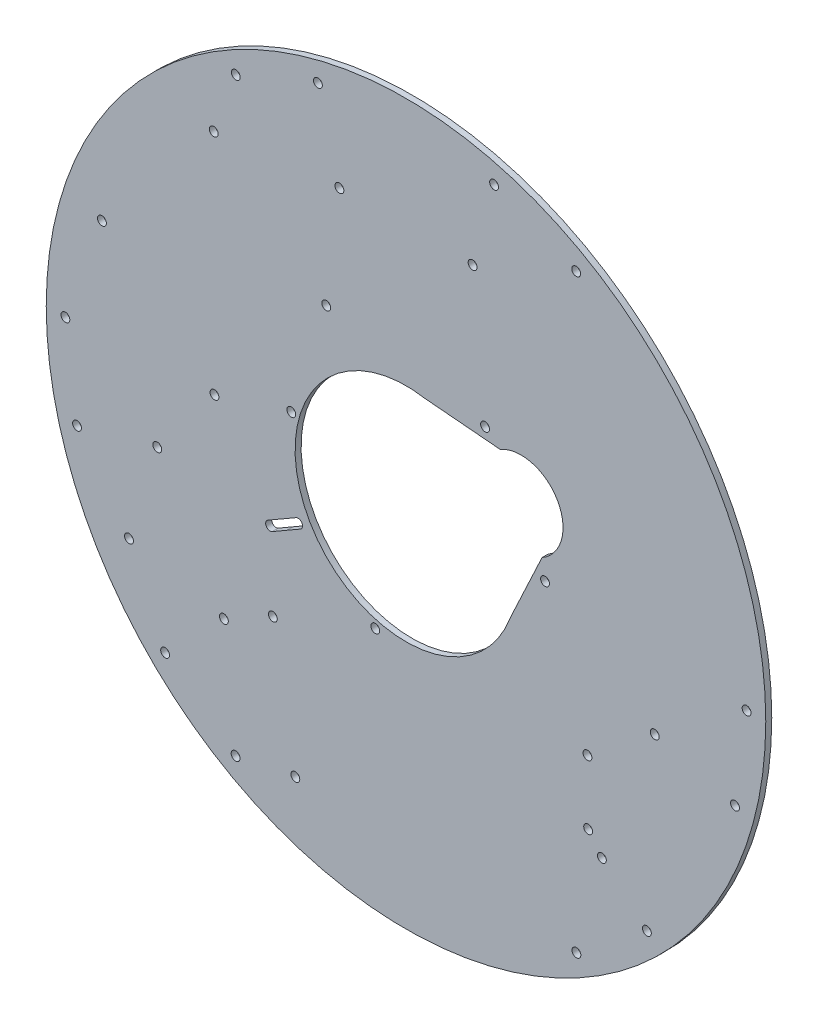
from build123d import *

# Parameters (mm, degrees)
SKETCH1_R           = 120.00268075
SKETCH1_R_2         = 1.475
BOSS_EXTRUDE1_DEPTH = 2


with BuildPart() as part:
    # Sketch1 → Boss-Extrude1 (new body)
    with BuildSketch(Plane.XY):
        with Locations((-29.695990648, 44.165693097)):
            Circle(SKETCH1_R)
        with Locations((-131.117764712, 78.090450262)):
            Circle(SKETCH1_R_2, mode=Mode.SUBTRACT)
        with Locations((-93.581586999, 46.593857387)):
            Circle(SKETCH1_R_2, mode=Mode.SUBTRACT)
        with Locations((-56.299905637, 91.024435088)):
            Circle(SKETCH1_R_2, mode=Mode.SUBTRACT)
        with Locations((-93.83608335, 122.521027963)):
            Circle(SKETCH1_R_2, mode=Mode.SUBTRACT)
        with Locations((-110.045426455, -36.150986818)):
            Circle(SKETCH1_R_2, mode=Mode.SUBTRACT)
        with Locations((-122.090933715, -9.178552154)):
            Circle(SKETCH1_R_2, mode=Mode.SUBTRACT)
        with Locations((-90.443310675, -16.556862192)):
            Circle(SKETCH1_R_2, mode=Mode.SUBTRACT)
        with Locations((-86.537268392, -54.200307389)):
            Circle(SKETCH1_R_2, mode=Mode.SUBTRACT)
        with Locations((-66.607427563, -50.274288778)):
            Circle(SKETCH1_R_2, mode=Mode.SUBTRACT)
        with Locations((-74.107508579, -7.739215663)):
            Circle(SKETCH1_R_2, mode=Mode.SUBTRACT)
        with Locations((-139.426993706, 14.739380466)):
            Circle(SKETCH1_R_2, mode=Mode.SUBTRACT)
        with Locations((-112.656926125, 21.918248387)):
            Circle(SKETCH1_R_2, mode=Mode.SUBTRACT)
        with Locations((-143.304084809, 44.12270283)):
            Circle(SKETCH1_R_2, mode=Mode.SUBTRACT)
        with BuildLine():
            ThreePointArc((-66.409488535, 24.672278037), (-65.290263608, 24.819626794), (-64.394660767, 24.132406564))
            ThreePointArc((-64.394660767, 24.132406564), (-64.247310389, 23.013187685), (-64.934521394, 22.117585057))
            Line((-64.934521394, 22.117585057), (-69.391907416, 19.544061572))
            Line((-69.391907416, 19.544061572), (-74.290393291, 16.715919433))
            ThreePointArc((-74.290393291, 16.715919433), (-75.409651382, 16.56856631), (-76.305280761, 17.255806904))
            ThreePointArc((-76.305280761, 17.255806904), (-76.452633885, 18.375064995), (-75.765393291, 19.270694374))
            Line((-75.765393291, 19.270694374), (-70.866896569, 22.098842775))
            Line((-70.866896569, 22.098842775), (-66.409488535, 24.672278037))
        make_face(mode=Mode.SUBTRACT)
        with Locations((-39.944701954, 5.916981791)):
            Circle(SKETCH1_R_2, mode=Mode.SUBTRACT)
        with Locations((27.145287096, -54.200307389)):
            Circle(SKETCH1_R_2, mode=Mode.SUBTRACT)
        with Locations((50.653445159, -36.150986818)):
            Circle(SKETCH1_R_2, mode=Mode.SUBTRACT)
        with Locations((31.051329379, -16.556862192)):
            Circle(SKETCH1_R_2, mode=Mode.SUBTRACT)
        with Locations((35.640132692, -22.598732381)):
            Circle(SKETCH1_R_2, mode=Mode.SUBTRACT)
        with BuildLine():
            ThreePointArc((-23.271008074, 7.727806236), (-45.332866332, 10.632304977), (-61.738930588, 25.665693097))
            ThreePointArc((-61.738930588, 25.665693097), (-66.555194477, 47.390455579), (-58.039635043, 67.948834656))
            ThreePointArc((-58.039635043, 67.948834656), (-42.381951879, 78.922942523), (-23.336458345, 80.615060018))
            Line((-23.336458345, 80.615060018), (1.683916538, 78.448698496))
            ThreePointArc((1.683916538, 78.448698496), (20.808272191, 73.324342843), (15.683916538, 54.19998719))
            Line((15.683916538, 54.19998719), (5.049853209, 31.448526168))
            ThreePointArc((5.049853209, 31.448526168), (-5.938310295, 15.800703687), (-23.271008074, 7.727806236))
        make_face(mode=Mode.SUBTRACT)
        with Locations((16.677076311, 47.845185022)):
            Circle(SKETCH1_R_2, mode=Mode.SUBTRACT)
        with Locations((30.83159843, 4.671820563)):
            Circle(SKETCH1_R_2, mode=Mode.SUBTRACT)
        with Locations((53.264944829, 21.918248387)):
            Circle(SKETCH1_R_2, mode=Mode.SUBTRACT)
        with Locations((80.03501241, 14.739380466)):
            Circle(SKETCH1_R_2, mode=Mode.SUBTRACT)
        with Locations((83.912103514, 44.12270283)):
            Circle(SKETCH1_R_2, mode=Mode.SUBTRACT)
        with Locations((-67.944701954, 54.414404403)):
            Circle(SKETCH1_R_2, mode=Mode.SUBTRACT)
        with Locations((-51.909606098, 127.135693097)):
            Circle(SKETCH1_R_2, mode=Mode.SUBTRACT)
        with Locations((-86.462807065, 142.57468385)):
            Circle(SKETCH1_R_2, mode=Mode.SUBTRACT)
        with Locations((-59.077557898, 153.908685644)):
            Circle(SKETCH1_R_2, mode=Mode.SUBTRACT)
        with Locations((-3.322923689, 82.486201173)):
            Circle(SKETCH1_R_2, mode=Mode.SUBTRACT)
        with Locations((-7.482375198, 127.135693097)):
            Circle(SKETCH1_R_2, mode=Mode.SUBTRACT)
        with Locations((-0.314423397, 153.908685644)):
            Circle(SKETCH1_R_2, mode=Mode.SUBTRACT)
        with Locations((27.070825769, 142.57468385)):
            Circle(SKETCH1_R_2, mode=Mode.SUBTRACT)
    extrude(amount=BOSS_EXTRUDE1_DEPTH)


solid = part.part
